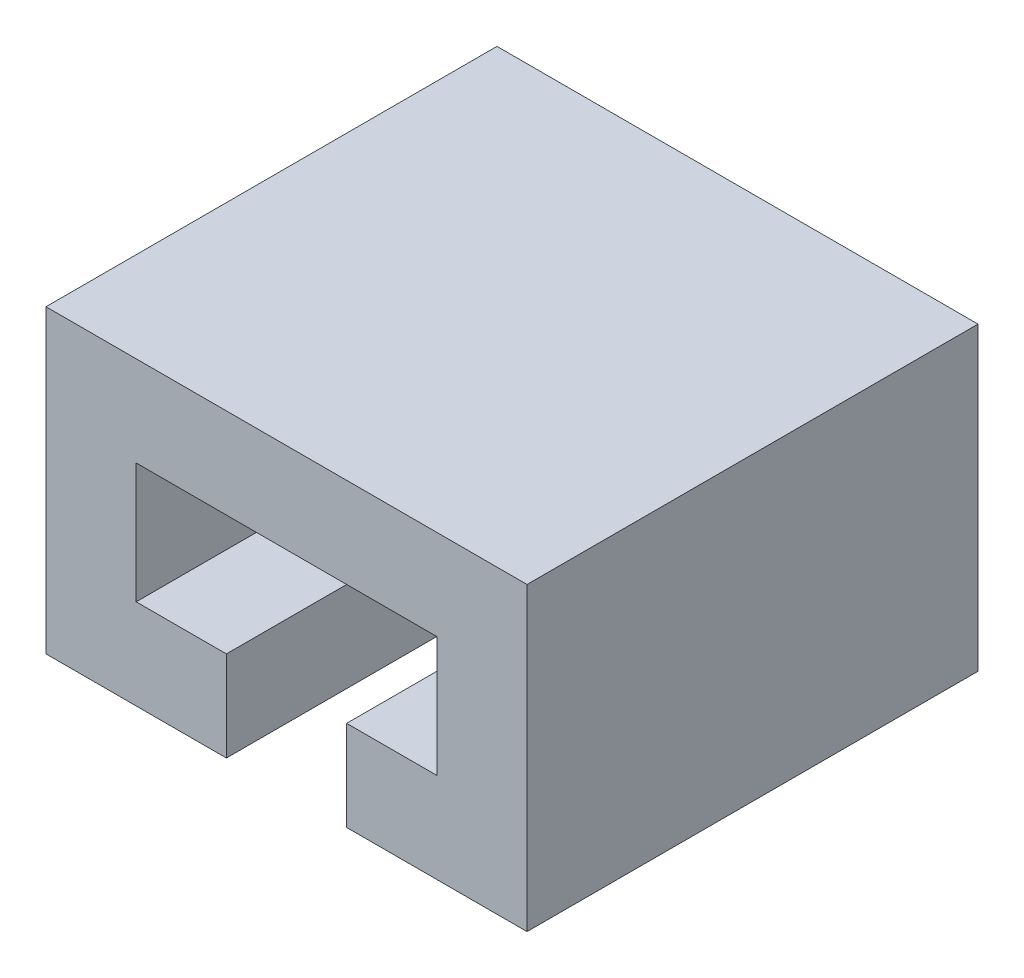
from build123d import *

# Parameters (mm, degrees)
EXTRUDE_1_DEPTH = 15


with BuildPart() as part:
    # 草图1 → 凸台-拉伸1 (new body)
    with BuildSketch(Plane.XY):
        Polygon((0, 0), (16, 0), (16, -10), (10, -10), (10, -7), (13, -7), (13, -3), (3, -3), (3, -7), (6, -7), (6, -10), (0, -10), align=None)
    extrude(amount=EXTRUDE_1_DEPTH)


solid = part.part
